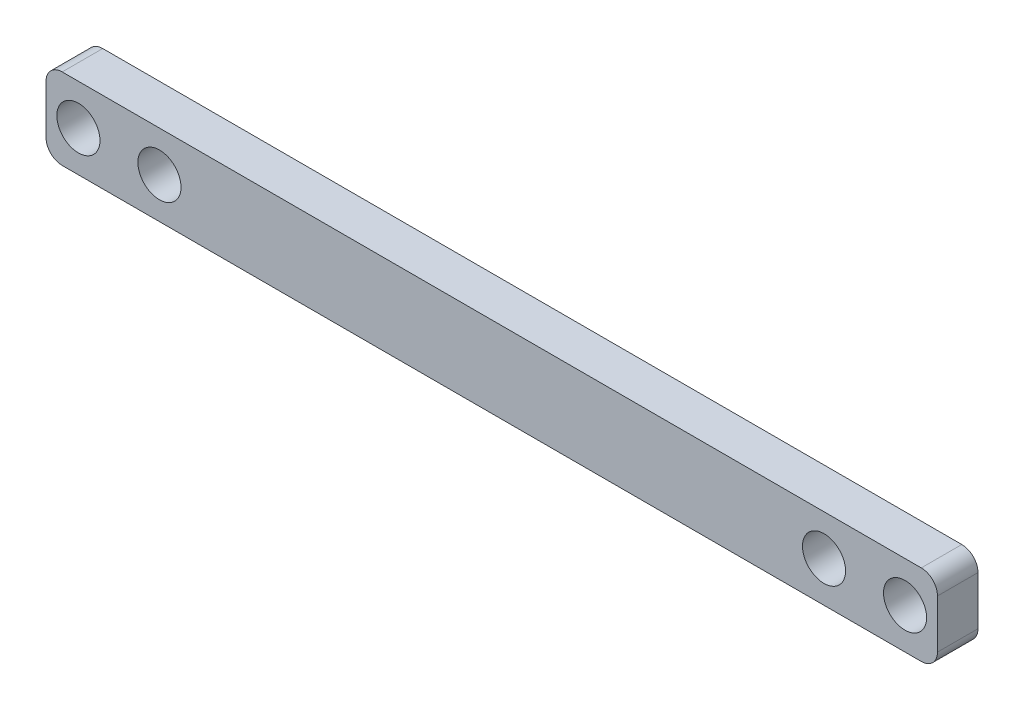
from build123d import *

# Parameters (mm, degrees)
SKETCH1_W                = 139.7
SKETCH1_H                = 12.7
BOSS_EXTRUDE1_DEPTH      = 6.35
H_0_266_DIAMETER_HOLE1_D = 6.7564
FILLET1_R                = 2.54


with BuildPart() as part:
    # Sketch1 → Boss-Extrude1 (new body)
    with BuildSketch(Plane.XY):
        Rectangle(SKETCH1_W, SKETCH1_H)
    extrude(amount=BOSS_EXTRUDE1_DEPTH)

    # H (0.266) Diameter Hole1 (through all)
    with Locations(Plane.XY.offset(6.35)):
        with Locations((-64.77, 0), (-52.07, 0), (52.07, 0), (64.77, 0)):
            Hole(H_0_266_DIAMETER_HOLE1_D / 2)

    # Fillet1
    fillet1_edges = [part.edges().sort_by_distance(p)[0] for p in [
        (69.85, -6.35, 3.175),
        (-69.85, -6.35, 3.175),
        (-69.85, 6.35, 3.175),
        (69.85, 6.35, 3.175),
    ]]
    fillet(fillet1_edges, radius=FILLET1_R)


solid = part.part
